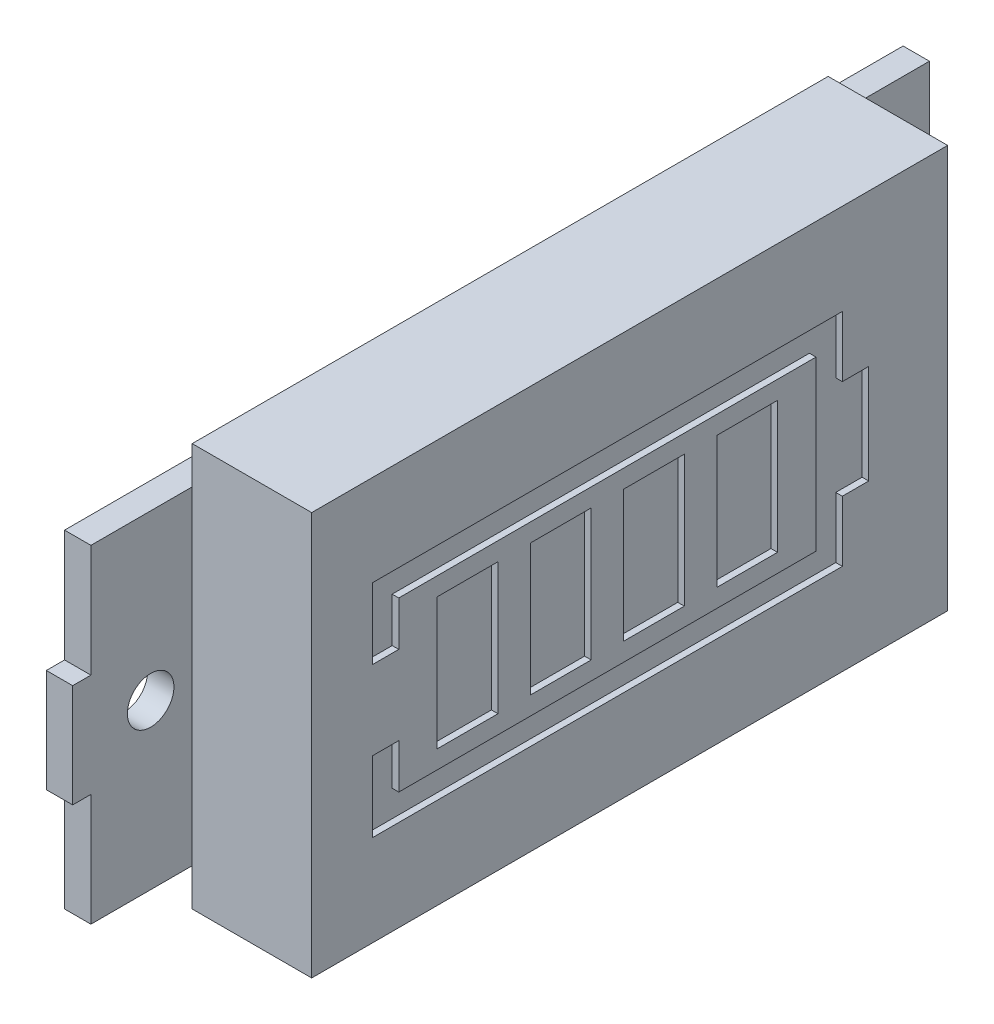
from build123d import *

# Parameters (mm, degrees)
CROQUIS1_W              = 31.4
CROQUIS1_H              = 19.9
SALIENTE_EXTRUIR1_DEPTH = 5.9
CROQUIS2_R              = 1.15
SALIENTE_EXTRUIR2_DEPTH = 1.3
CROQUIS3_W              = 3.9
CROQUIS3_H              = 8.9
SALIENTE_EXTRUIR3_DEPTH = 1.3
CROQUIS4_W              = 2
CROQUIS4_H              = 0.6
SALIENTE_EXTRUIR4_DEPTH = 0.325
MATRIZL1_COUNT          = 2
MATRIZL1_PITCH          = 5.9
MATRIZL1_COUNT_DIR2     = 5
MATRIZL1_PITCH_DIR2     = 1.7
CROQUIS5_W              = 3
CROQUIS5_H              = 6.5
CORTAR_EXTRUIR1_DEPTH   = 0.325


with BuildPart() as part:
    # Croquis1 → Saliente-Extruir1 (new body)
    with BuildSketch(Plane(origin=(0, 0, 0), x_dir=(0, 0, -1), z_dir=(1, 0, 0))):
        Rectangle(CROQUIS1_W, CROQUIS1_H)
    extrude(amount=SALIENTE_EXTRUIR1_DEPTH)

    # Croquis2 → Saliente-Extruir2 (add)
    with BuildSketch(Plane.ZY):
        Polygon((21.6, 2.55), (21.6, -2.55), (20.7, -2.55), (20.7, -8.1), (-20.7, -8.1), (-20.7, -2.55), (-21.6, -2.55), (-21.6, 2.55), (-20.7, 2.55), (-20.7, 8.1), (20.7, 8.1), (20.7, 2.55), align=None)
        with Locations((-17.75, 0)):
            Circle(CROQUIS2_R, mode=Mode.SUBTRACT)
        with Locations((17.75, 0)):
            Circle(CROQUIS2_R, mode=Mode.SUBTRACT)
    extrude(amount=SALIENTE_EXTRUIR2_DEPTH)

    # Croquis3 → Saliente-Extruir3 (add)
    with BuildSketch(Plane.ZY.offset(1.3)):
        with Locations((-10.45, -0.15)):
            Rectangle(CROQUIS3_W, CROQUIS3_H)
    extrude(amount=SALIENTE_EXTRUIR3_DEPTH)

    # Croquis4 → Saliente-Extruir4 (add)
    with BuildSketch(Plane.ZY.offset(1.3)):
        with Locations((-7.5, -4.05)):
            Rectangle(CROQUIS4_W, CROQUIS4_H)
    saliente_extruir4 = extrude(amount=SALIENTE_EXTRUIR4_DEPTH)

    # MatrizL1: Saliente-Extruir4 2 × 5
    with Locations(*[(0, j * MATRIZL1_PITCH_DIR2, -i * MATRIZL1_PITCH) for i in range(MATRIZL1_COUNT) for j in range(MATRIZL1_COUNT_DIR2) if (i, j) != (0, 0)]):
        add(saliente_extruir4)

    # Croquis5 → Cortar-Extruir1 (cut)
    with BuildSketch(Plane(origin=(5.9, 0, 0), x_dir=(0, 0, -1), z_dir=(1, 0, 0))):
        Polygon((-12.7, 1.95), (-12.7, 5.45), (10.5, 5.45), (10.5, 2.45), (11.8, 2.45), (11.8, -2.45), (10.5, -2.45), (10.5, -5.45), (-12.7, -5.45), (-12.7, -1.95), (-11.4, -1.95), (-11.4, -4.15), (9.2, -4.15), (9.2, -1.15), (9.2, 1.15), (9.2, 4.15), (-11.4, 4.15), (-11.4, 1.95), align=None)
        with Locations((1.2, 0)):
            Rectangle(CROQUIS5_W, CROQUIS5_H)
        with Locations((5.8, 0)):
            Rectangle(CROQUIS5_W, CROQUIS5_H)
        with Locations((-3.4, 0)):
            Rectangle(CROQUIS5_W, CROQUIS5_H)
        with Locations((-8, 0)):
            Rectangle(CROQUIS5_W, CROQUIS5_H)
    extrude(amount=-CORTAR_EXTRUIR1_DEPTH, mode=Mode.SUBTRACT)


solid = part.part
